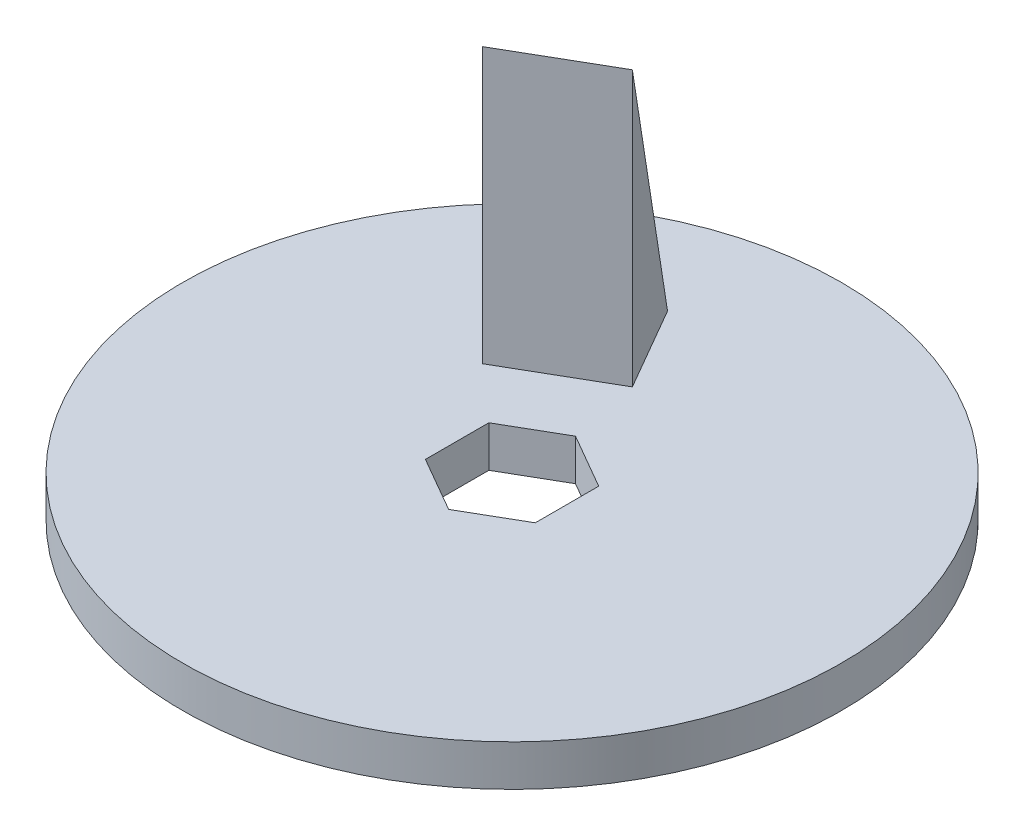
from build123d import *

# Parameters (mm, degrees)
BOSS_EXTRUDE1_DEPTH = 19.05
BOSS_EXTRUDE2_DEPTH = 127
CUT_EXTRUDE1_DEPTH  = 282.074619797


with BuildPart() as part:
    # Sketch2 → Boss-Extrude1 (new body)
    # profile 1 of 5: a face of its own
    with BuildSketch(Plane(origin=(0, 0, 0), x_dir=(1, 0, 0), z_dir=(0, 1, 0))):
        with BuildLine():
            ThreePointArc((-149.056021348, 31.75), (-151.561699735, 15.962805935), (-152.4, 0))
            Line((-152.4, 0), (-139.7, 0))
            Line((-139.7, 0), (-139.7, 31.75))
            Line((-139.7, 31.75), (-149.056021348, 31.75))
        make_face()
    # profile 2 of 5: a face of its own
    with BuildSketch(Plane(origin=(0, 0, 0), x_dir=(1, 0, 0), z_dir=(0, 1, 0))):
        with BuildLine():
            ThreePointArc((0, 152.4), (-15.962805935, 151.561699735), (-31.75, 149.056021348))
            Line((-31.75, 149.056021348), (-31.75, 139.7))
            Line((-31.75, 139.7), (0, 139.7))
            Line((0, 139.7), (0, 152.4))
        make_face()
    # profile 3 of 5: a face of its own
    with BuildSketch(Plane(origin=(0, 0, 0), x_dir=(1, 0, 0), z_dir=(0, 1, 0))):
        with BuildLine():
            Line((139.7, -31.75), (149.056021348, -31.75))
            ThreePointArc((149.056021348, -31.75), (151.561699735, -15.962805935), (152.4, 0))
            Line((152.4, 0), (139.7, 0))
            Line((139.7, 0), (139.7, -31.75))
        make_face()
    # profile 4 of 5: a face of its own
    with BuildSketch(Plane(origin=(0, 0, 0), x_dir=(1, 0, 0), z_dir=(0, 1, 0))):
        with BuildLine():
            Line((0, -139.7), (0, -152.4))
            ThreePointArc((0, -152.4), (15.962805935, -151.561699735), (31.75, -149.056021348))
            Line((31.75, -149.056021348), (31.75, -139.7))
            Line((31.75, -139.7), (0, -139.7))
        make_face()
    # profile 5 of 5: a face of its own
    with BuildSketch(Plane(origin=(0, 0, 0), x_dir=(1, 0, 0), z_dir=(0, 1, 0))):
        with BuildLine():
            Line((-139.7, 0), (-152.4, 0))
            ThreePointArc((-152.4, 0), (-107.763073453, -107.763073453), (0, -152.4))
            Line((0, -152.4), (0, -139.7))
            Line((0, -139.7), (31.75, -139.7))
            Line((31.75, -139.7), (31.75, -149.056021348))
            ThreePointArc((31.75, -149.056021348), (107.763073453, -107.763073453), (149.056021348, -31.75))
            Line((149.056021348, -31.75), (139.7, -31.75))
            Line((139.7, -31.75), (139.7, 0))
            Line((139.7, 0), (152.4, 0))
            ThreePointArc((152.4, 0), (107.763073453, 107.763073453), (0, 152.4))
            Line((0, 152.4), (0, 139.7))
            Line((0, 139.7), (-31.75, 139.7))
            Line((-31.75, 139.7), (-31.75, 149.056021348))
            ThreePointArc((-31.75, 149.056021348), (-107.763073453, 107.763073453), (-149.056021348, 31.75))
            Line((-149.056021348, 31.75), (-139.7, 31.75))
            Line((-139.7, 31.75), (-139.7, 0))
        make_face()
        Polygon((-25.4, 14.664696837), (0, 29.329393675), (25.4, 14.664696837), (25.4, -14.664696837), (0, -29.329393675), (-25.4, -14.664696837), align=None, mode=Mode.SUBTRACT)
    extrude(amount=BOSS_EXTRUDE1_DEPTH)

    # Sketch3 → Boss-Extrude2 (add)
    with BuildSketch(Plane(origin=(0, 19.05, 0), x_dir=(1, 0, 0), z_dir=(0, 1, 0))):
        Polygon((-50.572045256, 36.793351826), (-72.797045256, 75.288181024), (-28.802954744, 100.688181024), (-6.577954744, 62.193351826), align=None)
    extrude(amount=BOSS_EXTRUDE2_DEPTH)

    # Sketch5 → Cut-Extrude1 (cut, through all)
    with BuildSketch(Plane(origin=(-21.997045256, 0, 12.7), x_dir=(0.5, 0, 0.8660254037844386), z_dir=(-0.8660254037844387, 0, 0.5000000000000001))):
        Polygon((-101.6, 19.05), (-101.6, 146.05), (-57.15, 146.05), align=None)
    extrude(amount=-CUT_EXTRUDE1_DEPTH, mode=Mode.SUBTRACT)


solid = part.part
